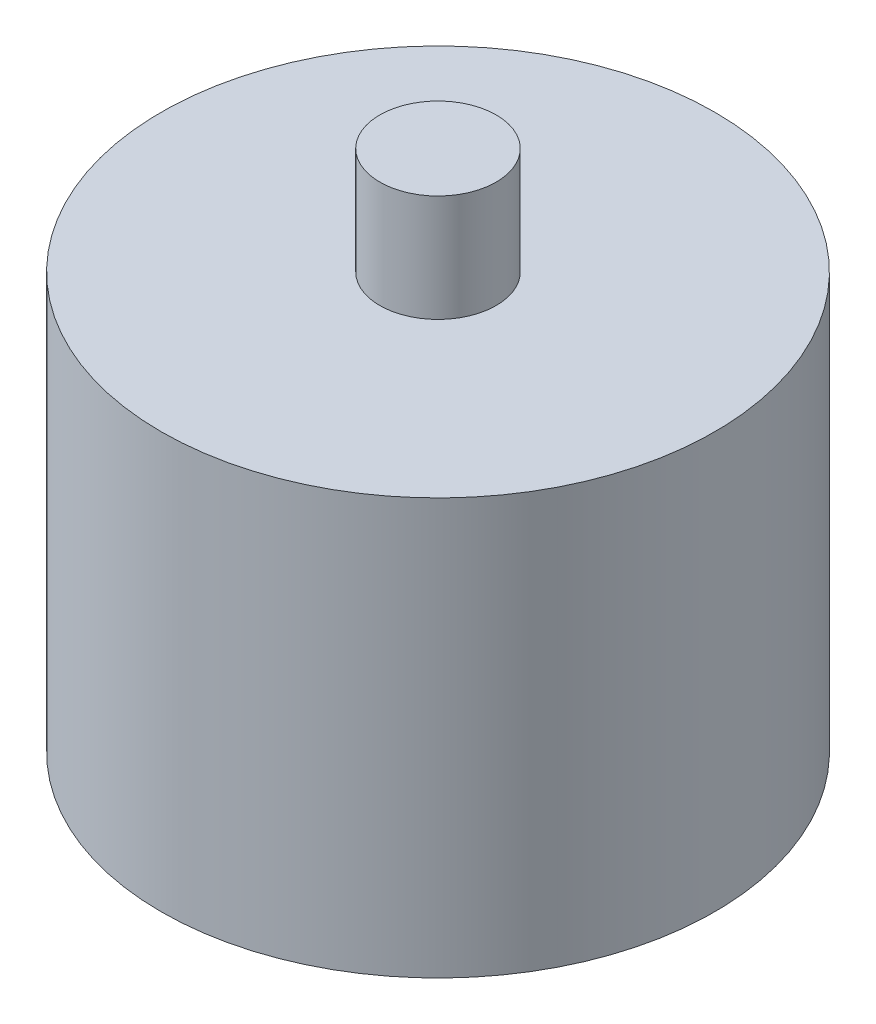
from build123d import *


with BuildPart() as part:
    # Sketch1 → Revolve1 (revolve)
    with BuildSketch(Plane.XY, mode=Mode.PRIVATE) as revolve1_sk:
        Polygon((31.221337852, 15.141678872), (31.221337852, 62.040684229), (6.56586075, 62.040684229), (6.56586075, 74.100428464), (0, 74.100428464), (0, 15.141678872), align=None)
    revolve(revolve1_sk.sketch.rotate(Axis((0, 0, 0), (0, 1, 0)), 90), axis=Axis((0, 0, 0), (0, 1, 0)))


solid = part.part
